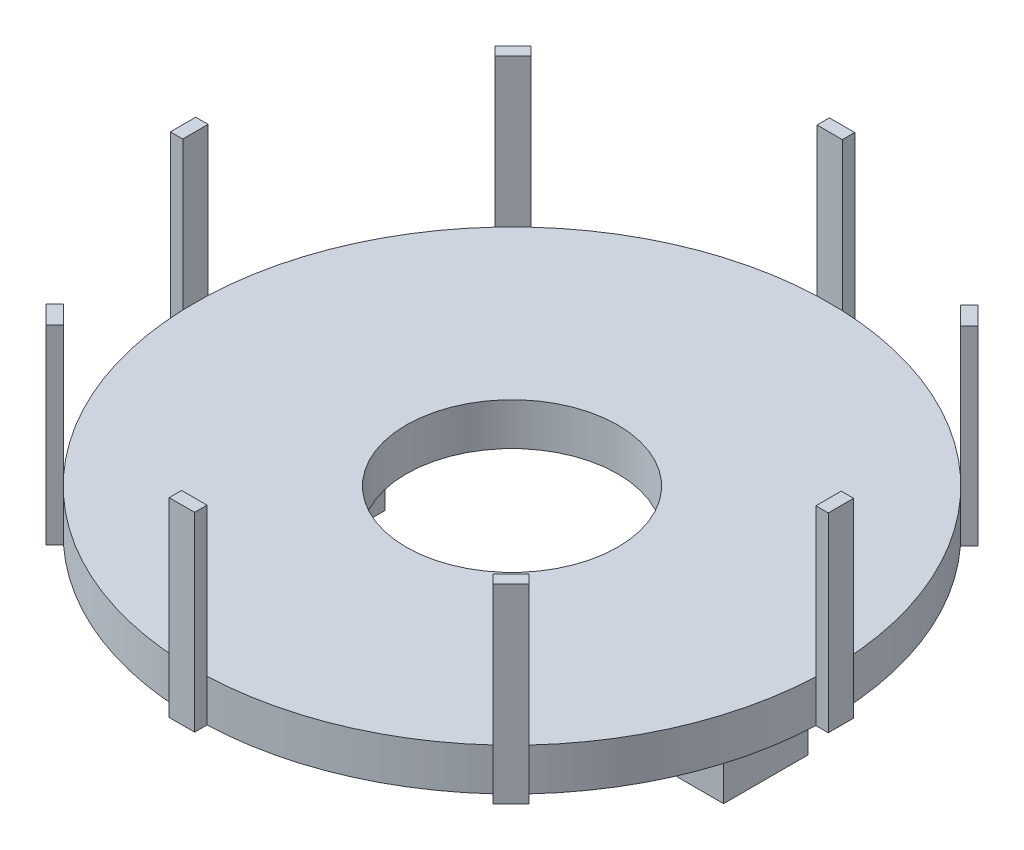
from build123d import *

# Parameters (mm, degrees)
SKETCH1_R           = 75
BOSS_EXTRUDE1_DEPTH = 10
SKETCH2_R           = 25
CUT_EXTRUDE1_DEPTH  = 10
SKETCH3_W           = 20
SKETCH3_H           = 20
BOSS_EXTRUDE2_DEPTH = 20
SKETCH4_R           = 5.1
CUT_EXTRUDE2_DEPTH  = 20
SKETCH5_W           = 6
SKETCH5_H           = 3.326162104
SKETCH5_W_2         = 3.326162104
SKETCH5_H_2         = 6
BOSS_EXTRUDE3_DEPTH = 10
SKETCH6_W           = 2.933357957
SKETCH6_H           = 6
BOSS_EXTRUDE4_DEPTH = 35


with BuildPart() as part:
    # Sketch1 → Boss-Extrude1 (new body)
    with BuildSketch(Plane(origin=(0, 0, 0), x_dir=(1, 0, 0), z_dir=(0, 1, 0))):
        with Locations(Location((0, 0, 0), (0, 0, 270))):
            Circle(SKETCH1_R)
    extrude(amount=BOSS_EXTRUDE1_DEPTH)

    # Sketch2 → Cut-Extrude1 (cut)
    with BuildSketch(Plane(origin=(0, 10, 0), x_dir=(1, 0, 0), z_dir=(0, 1, 0))):
        with Locations(Location((0, 0, 0), (0, 0, 270))):
            Circle(SKETCH2_R)
    extrude(amount=-CUT_EXTRUDE1_DEPTH, mode=Mode.SUBTRACT)

    # Sketch3 → Boss-Extrude2 (add)
    with BuildSketch(Plane.XZ):
        with Locations((50, 0)):
            Rectangle(SKETCH3_W, SKETCH3_H)
        with Locations((-50, 0)):
            Rectangle(SKETCH3_W, SKETCH3_H)
    extrude(amount=BOSS_EXTRUDE2_DEPTH)

    # Sketch4 → Cut-Extrude2 (cut)
    with BuildSketch(Plane.XZ.offset(20)):
        with Locations(Location((-50, 0, 0), (0, 0, 270))):
            Circle(SKETCH4_R)
        with Locations(Location((50, 0, 0), (0, 0, 270))):
            Circle(SKETCH4_R)
    extrude(amount=-CUT_EXTRUDE2_DEPTH, mode=Mode.SUBTRACT)

    # Sketch5 → Boss-Extrude3 (add)
    with BuildSketch(Plane(origin=(0, 10, 0), x_dir=(1, 0, 0), z_dir=(0, 1, 0))):
        Polygon((53.03387152, 57.087936355), (50.681919741, 54.735984576), (54.924560428, 50.493343889), (57.276512207, 52.845295668), align=None)
        with Locations((0.133343264, 76.204796053)):
            Rectangle(SKETCH5_W, SKETCH5_H)
        with Locations((76.204796053, -0.133343264)):
            Rectangle(SKETCH5_W_2, SKETCH5_H_2)
        Polygon((57.087936355, -53.03387152), (54.735984576, -50.681919741), (50.493343889, -54.924560428), (52.845295668, -57.276512207), align=None)
        with Locations((-0.133343264, -76.204796053)):
            Rectangle(SKETCH5_W, SKETCH5_H)
        Polygon((-53.03387152, -57.087936355), (-50.681919741, -54.735984576), (-54.924560428, -50.493343889), (-57.276512207, -52.845295668), align=None)
        with Locations((-76.204796053, 0.133343264)):
            Rectangle(SKETCH5_W_2, SKETCH5_H_2)
        Polygon((-57.087936355, 53.03387152), (-54.735984576, 50.681919741), (-50.493343889, 54.924560428), (-52.845295668, 57.276512207), align=None)
    extrude(amount=-BOSS_EXTRUDE3_DEPTH)

    # Sketch6 → Boss-Extrude4 (add)
    with BuildSketch(Plane(origin=(0, 10, 0), x_dir=(1, 0, 0), z_dir=(0, 1, 0))):
        Polygon((-2.866656736, 74.934519148), (0.128320094, 74.934519148), (0.133343264, 77.867877105), (-2.866656736, 77.867877105), (-2.866656736, 74.945195171), align=None)
        Polygon((0.133343264, 77.867877105), (0.128320094, 74.934519148), (3.133343264, 74.934519148), (3.133343264, 77.867877105), align=None)
        Polygon((-52.845295668, 57.276512207), (-57.087936355, 53.03387152), (-55.02128814, 50.967223305), (-55.013739052, 50.959674217), (-50.771098365, 55.202314904), align=None)
        Polygon((-57.276512207, -52.845295668), (-53.03387152, -57.087936355), (-50.967223305, -55.02128814), (-50.959674217, -55.013739052), (-55.202314904, -50.771098365), align=None)
        Polygon((-3.133343264, -77.867877105), (2.866656736, -77.867877105), (2.866656736, -74.945195171), (2.866656736, -74.934519148), (-3.133343264, -74.934519148), align=None)
        Polygon((52.845295668, -57.276512207), (57.087936355, -53.03387152), (55.02128814, -50.967223305), (55.013739052, -50.959674217), (50.771098365, -55.202314904), align=None)
        Polygon((77.867877105, -3.133343264), (77.867877105, 2.866656736), (74.945195171, 2.866656736), (74.934519148, 2.866656736), (74.934519148, -3.133343264), align=None)
        Polygon((57.276512207, 52.845295668), (53.03387152, 57.087936355), (50.967223305, 55.02128814), (50.959674217, 55.013739052), (55.202314904, 50.771098365), align=None)
        with Locations((-76.401198127, 0.133343264)):
            Rectangle(SKETCH6_W, SKETCH6_H)
    extrude(amount=BOSS_EXTRUDE4_DEPTH)


solid = part.part
